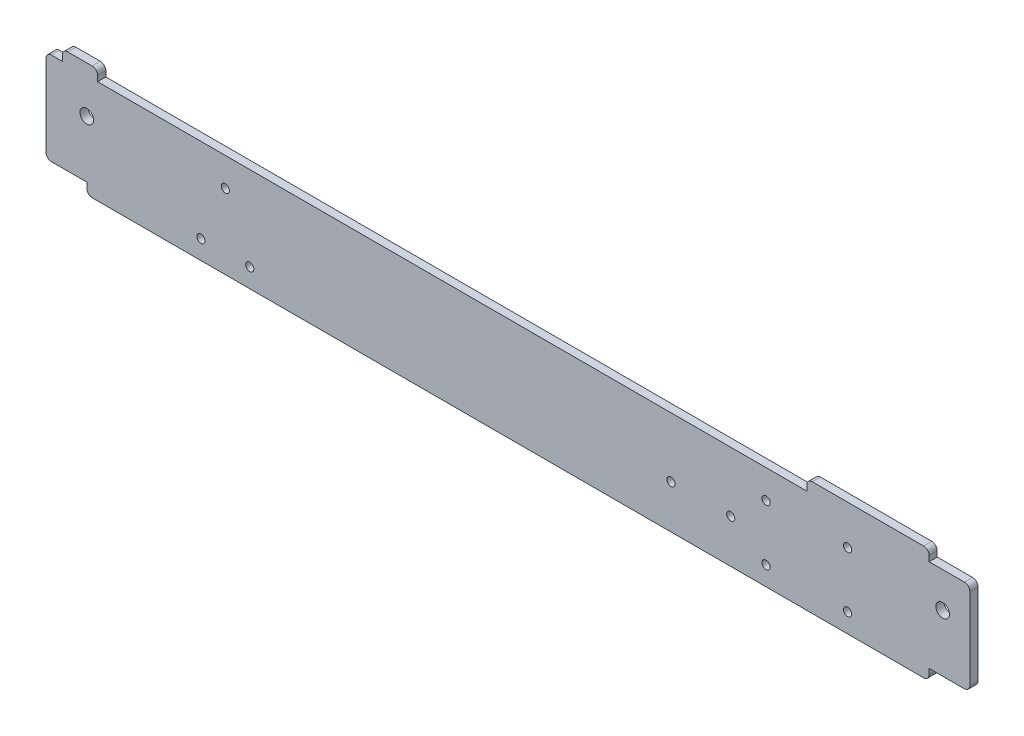
from build123d import *

# Parameters (mm, degrees)
CROQUIS1_W                                 = 340
CROQUIS1_H                                 = 42
CROQUIS1_R                                 = 2.5
CROQUIS1_R_2                               = 1.5
SALIENTE_EXTRUIR1_DEPTH                    = 3
CROQUIS2_W                                 = 15
CROQUIS2_H                                 = 4
CORTAR_EXTRUIR1_DEPTH                      = 172.31841699
SIMETR_A1_AT_THE_SECOND_PLANE_COPY_1_SKE_W = 15
SIMETR_A1_AT_THE_SECOND_PLANE_COPY_1_SKE_H = 4
SIMETR_A1_AT_THE_SECOND_PLANE_COPY_1_DEPTH = 172.31841699
REDONDEO1_R                                = 2
CROQUIS3_W                                 = 261
CROQUIS3_H                                 = 11.873622062
CORTAR_EXTRUIR2_DEPTH                      = 172.31841699
CROQUIS7_W                                 = 13
CROQUIS7_H                                 = 4
SALIENTE_EXTRUIR3_DEPTH                    = 3
REDONDEO2_R                                = 2


with BuildPart() as part:
    # Croquis1 → Saliente-Extruir1 (new body)
    with BuildSketch(Plane.XY):
        Rectangle(CROQUIS1_W, CROQUIS1_H)
        with Locations((160, 4)):
            Circle(CROQUIS1_R, mode=Mode.SUBTRACT)
        with Locations((95, 6.5)):
            Circle(CROQUIS1_R_2, mode=Mode.SUBTRACT)
        with Locations((125, -14)):
            Circle(CROQUIS1_R_2, mode=Mode.SUBTRACT)
        with Locations((95, -14)):
            Circle(CROQUIS1_R_2, mode=Mode.SUBTRACT)
        with Locations((125, 6.5)):
            Circle(CROQUIS1_R_2, mode=Mode.SUBTRACT)
        with Locations((-113, -14)):
            Circle(CROQUIS1_R_2, mode=Mode.SUBTRACT)
        with Locations((-104, 6.5)):
            Circle(CROQUIS1_R_2, mode=Mode.SUBTRACT)
        with Locations((-95, -14)):
            Circle(CROQUIS1_R_2, mode=Mode.SUBTRACT)
        with Locations((-155, 4)):
            Circle(CROQUIS1_R, mode=Mode.SUBTRACT)
        with Locations((82, -5)):
            Circle(CROQUIS1_R_2, mode=Mode.SUBTRACT)
        with Locations((60, -5)):
            Circle(CROQUIS1_R_2, mode=Mode.SUBTRACT)
    extrude(amount=SALIENTE_EXTRUIR1_DEPTH)

    # Croquis2 → Cortar-Extruir1 (cut, through all)
    with BuildSketch(Plane.XY.offset(3)):
        with Locations((-162.5, -19)):
            Rectangle(CROQUIS2_W, CROQUIS2_H)
    cortar_extruir1 = extrude(amount=-CORTAR_EXTRUIR1_DEPTH, mode=Mode.SUBTRACT)

    # Simetría1: Cortar-Extruir1 across plane
    add(cortar_extruir1.mirror(Plane.ZX), mode=Mode.SUBTRACT)

    # Simetría1 at the second plane: Cortar-Extruir1 across plane
    add(cortar_extruir1.mirror(Plane(origin=(0, 0, 0), x_dir=(0, 0, 1), z_dir=(1, 0, 0))), mode=Mode.SUBTRACT)

    # Simetría1 at the second plane copy 1 ske → Simetría1 at the second plane copy 1 (cut, through all)
    with BuildSketch(Plane(origin=(0, 0, 3), x_dir=(-1, 0, 0), z_dir=(0, 0, 1))):
        with Locations((-162.5, -19)):
            Rectangle(SIMETR_A1_AT_THE_SECOND_PLANE_COPY_1_SKE_W, SIMETR_A1_AT_THE_SECOND_PLANE_COPY_1_SKE_H)
    extrude(amount=-SIMETR_A1_AT_THE_SECOND_PLANE_COPY_1_DEPTH, mode=Mode.SUBTRACT)

    # Redondeo1
    redondeo1_edges = [part.edges().sort_by_distance(p)[0] for p in [
        (170, 17, 1.5),
        (155, 21, 1.5),
        (-170, -17, 1.5),
        (-155, -21, 1.5),
        (170, -17, 1.5),
        (155, -21, 1.5),
        (-170, 17, 1.5),
    ]]
    fillet(redondeo1_edges, radius=REDONDEO1_R)

    # Croquis3 → Cortar-Extruir2 (cut, through all)
    with BuildSketch(Plane.XY.offset(3)):
        with Locations((-20.5, 22.936811031)):
            Rectangle(CROQUIS3_W, CROQUIS3_H)
    extrude(amount=-CORTAR_EXTRUIR2_DEPTH, mode=Mode.SUBTRACT)

    # Croquis7 → Saliente-Extruir3 (add)
    with BuildSketch(Plane.XY.offset(3)):
        with Locations((-157.5, 19)):
            Rectangle(CROQUIS7_W, CROQUIS7_H)
    extrude(amount=-SALIENTE_EXTRUIR3_DEPTH)

    # Redondeo2
    redondeo2_edges = [part.edges().sort_by_distance(p)[0] for p in [
        (110, 21, 1.5),
        (-151, 21, 1.5),
        (-164, 21, 1.5),
    ]]
    fillet(redondeo2_edges, radius=REDONDEO2_R)


solid = part.part
